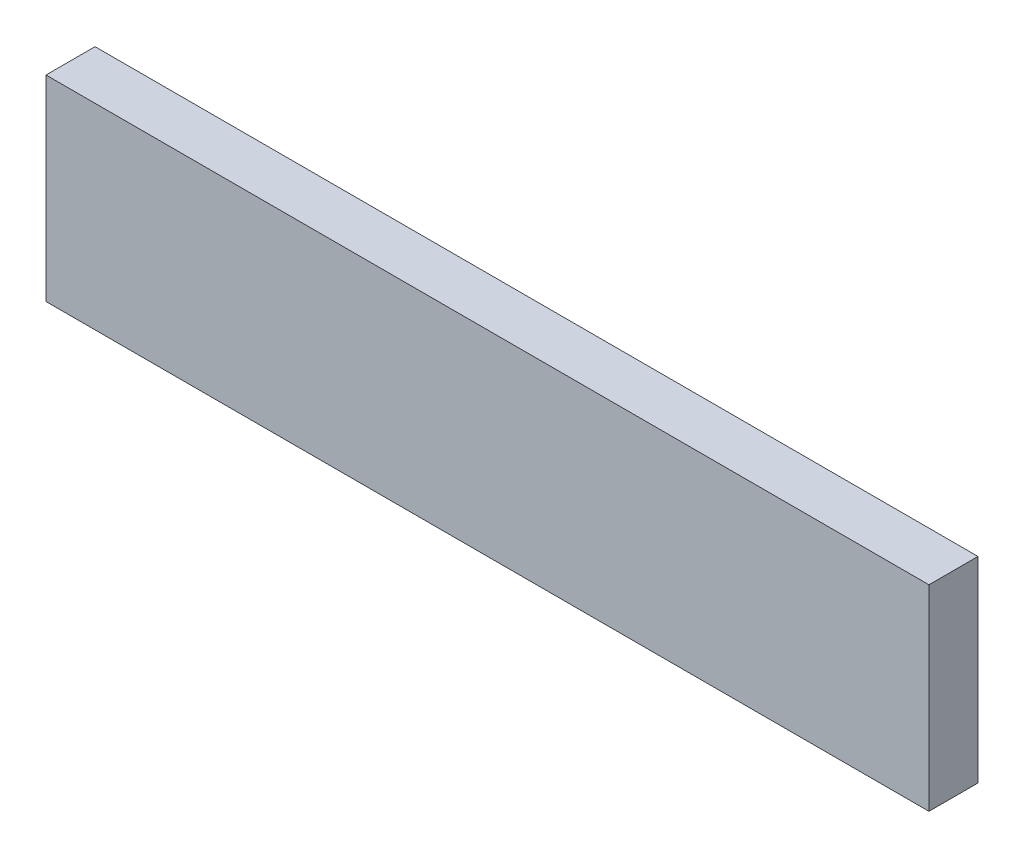
from build123d import *

# Parameters (mm, degrees)
ESQUISSE1_W        = 90
ESQUISSE1_H        = 20
BOSS_EXTRU_1_DEPTH = 5


with BuildPart() as part:
    # Esquisse1 → Boss.-Extru.1 (new body)
    with BuildSketch(Plane.XY):
        with Locations((-45, 10)):
            Rectangle(ESQUISSE1_W, ESQUISSE1_H)
    extrude(amount=BOSS_EXTRU_1_DEPTH)


solid = part.part
